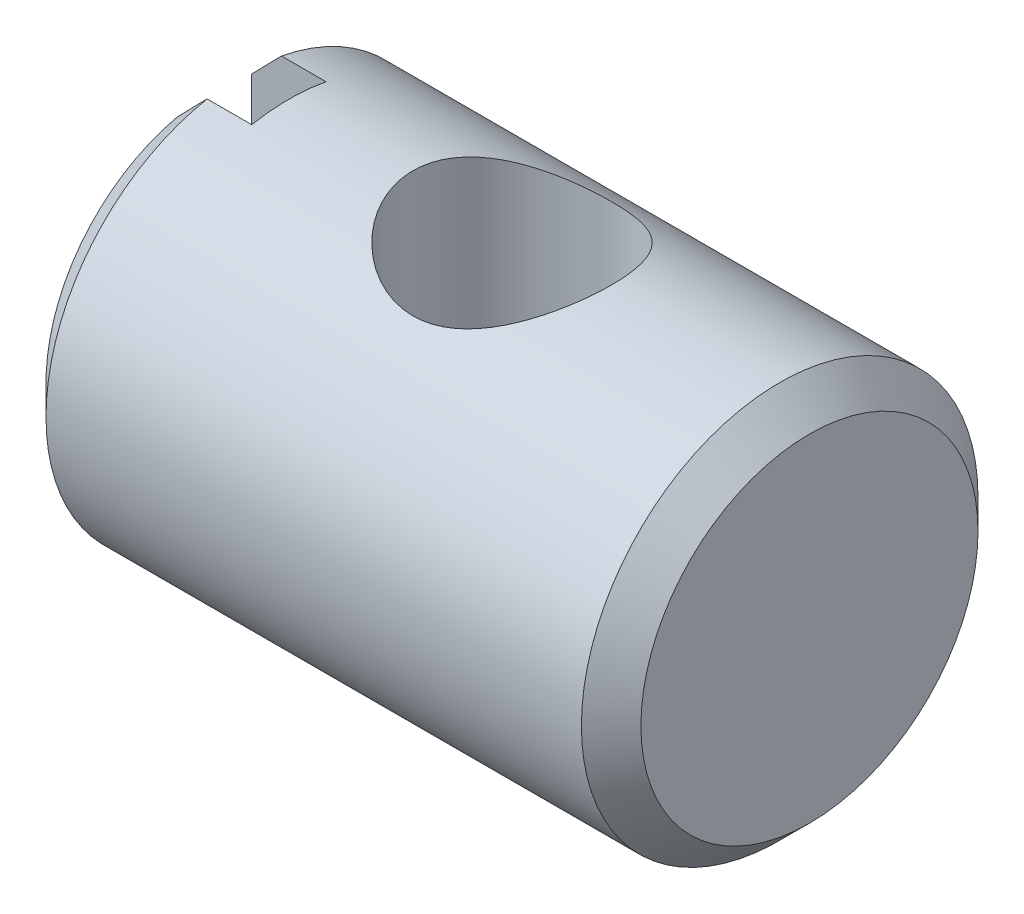
from build123d import *

# Parameters (mm, degrees)
SKETCH1_R               = 4
BOSS_EXTRUDE1_DEPTH     = 6
CHAMFER1_SIZE           = 0.6
CUT_EXTRUDE1_DEPTH      = 9.246211251
CUT_EXTRUDE1_DEPTH_BACK = 9.246211251
SKETCH2_R               = 2
SKETCH3_W               = 1.5
SKETCH3_H               = 10.178727068
CUT_EXTRUDE2_DEPTH      = 1.5


with BuildPart() as part:
    # Sketch1 → Boss-Extrude1 (new, symmetric)
    with BuildSketch(Plane(origin=(0, 0, 0), x_dir=(0, 0, -1), z_dir=(1, 0, 0))):
        Circle(SKETCH1_R)
    extrude(amount=BOSS_EXTRUDE1_DEPTH, both=True)

    # Chamfer1
    chamfer1_edges = [part.edges().sort_by_distance(p)[0] for p in [
        (-6, 0, 4),
        (6, 0, 4),
    ]]
    chamfer(chamfer1_edges, length=CHAMFER1_SIZE)

    # Sketch2 → Cut-Extrude1 (cut, two sides: drawn at the far end of the back side and taken through both)
    with BuildSketch(Plane(origin=(0, 0, 0), x_dir=(1, 0, 0), z_dir=(0, 1, 0)).offset(-CUT_EXTRUDE1_DEPTH_BACK)):
        with Locations(Location((0, 0, 0), (0, 0, 270))):
            Circle(SKETCH2_R)
    extrude(amount=CUT_EXTRUDE1_DEPTH + CUT_EXTRUDE1_DEPTH_BACK, mode=Mode.SUBTRACT)

    # Sketch3 → Cut-Extrude2 (cut)
    with BuildSketch(Plane.ZY.offset(6)):
        Rectangle(SKETCH3_W, SKETCH3_H)
    extrude(amount=-CUT_EXTRUDE2_DEPTH, mode=Mode.SUBTRACT)


solid = part.part
